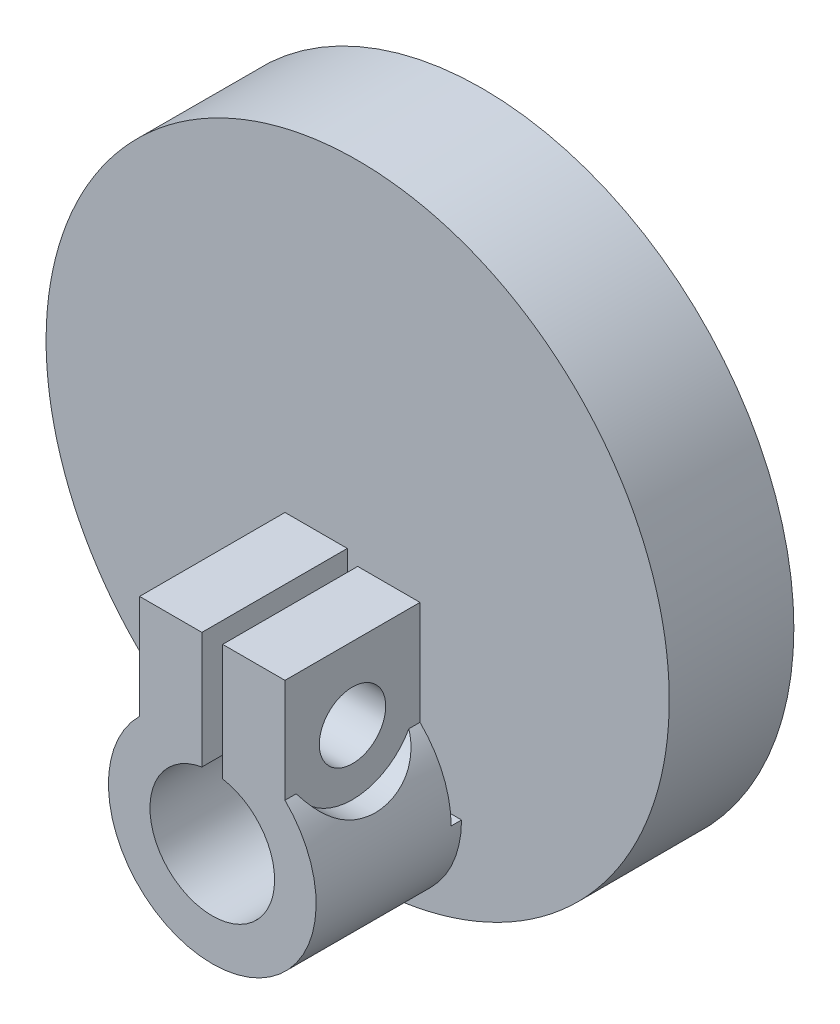
from build123d import *

# Parameters (mm, degrees)
SKETCH2_R                      = 15
SKETCH2_R_2                    = 3
BOSS_EXTRUDE1_DEPTH            = 6
BOSS_EXTRUDE2_DEPTH            = 7
CUT_EXTRUDE1_REACH             = 29.134
SKETCH4_W                      = 0.5
SKETCH4_H                      = 8.570714214
CUT_EXTRUDE1_DIRECTION_2_DEPTH = 28.133927102
SKETCH5_R                      = 1.6
CUT_EXTRUDE2_DEPTH             = 28.133927102
SKETCH6_R                      = 3.1
CUT_EXTRUDE3_DEPTH             = 28.133927206
SKETCH7_R                      = 3.1
CUT_EXTRUDE4_DEPTH             = 28.133927206


with BuildPart() as part:
    # Sketch2 → Boss-Extrude1 (new body)
    with BuildSketch(Plane.XY):
        Circle(SKETCH2_R)
        with Locations((0, -10)):
            Circle(SKETCH2_R_2, mode=Mode.SUBTRACT)
    extrude(amount=BOSS_EXTRUDE1_DEPTH)

    # Sketch3 → Boss-Extrude2 (add)
    with BuildSketch(Plane.XY.offset(6)):
        with BuildLine():
            Line((0.5, -7.041960108), (0.5, -1.429285786))
            Line((0.5, -1.429285786), (3.5, -1.429285786))
            Line((3.5, -1.429285786), (3.5, -6.429285786))
            ThreePointArc((3.5, -6.429285786), (0, -15), (-3.5, -6.429285786))
            Line((-3.5, -6.429285786), (-3.5, -1.429285786))
            Line((-3.5, -1.429285786), (-0.5, -1.429285786))
            Line((-0.5, -1.429285786), (-0.5, -7.041960108))
            ThreePointArc((-0.5, -7.041960108), (0, -13), (0.5, -7.041960108))
        make_face()
    extrude(amount=BOSS_EXTRUDE2_DEPTH)

    # Cut-Extrude1: up to this face of the body (flat: up to its plane)
    cut_extrude1_end = Plane(part.part.faces().sort_by_distance((-0.5, -4.235622947, 9.5))[0])
    # Sketch4 → Cut-Extrude1 (cut, up to the picked face)
    with BuildSketch(Plane(origin=(3.5, 0, 0), x_dir=(0, 0, -1), z_dir=(1, 0, 0)), mode=Mode.PRIVATE) as cut_extrude1_sk1:
        with Locations((-6.25, -5.714642893)):
            Rectangle(SKETCH4_W, SKETCH4_H)
    cut_extrude1_tool1 = split(extrude(cut_extrude1_sk1.sketch, amount=-CUT_EXTRUDE1_REACH, mode=Mode.PRIVATE), bisect_by=cut_extrude1_end, keep=Keep.BOTH, mode=Mode.PRIVATE)
    add(cut_extrude1_tool1.solids().sort_by(Axis((3.5, -5.714643, 6.25), (-1, 0, 0)))[0], mode=Mode.SUBTRACT)

    # Sketch4 → Cut-Extrude1 direction 2 (cut)
    with BuildSketch(Plane(origin=(3.5, 0, 0), x_dir=(0, 0, -1), z_dir=(1, 0, 0))):
        with Locations((-6.25, -5.714642893)):
            Rectangle(SKETCH4_W, SKETCH4_H)
    extrude(amount=CUT_EXTRUDE1_DIRECTION_2_DEPTH, mode=Mode.SUBTRACT)

    # Sketch5 → Cut-Extrude2 (cut, through all)
    with BuildSketch(Plane(origin=(3.5, 0, 0), x_dir=(0, 0, -1), z_dir=(1, 0, 0))):
        with Locations((-9.75, -4.929285786)):
            Circle(SKETCH5_R)
    extrude(amount=-CUT_EXTRUDE2_DEPTH, mode=Mode.SUBTRACT)

    # Sketch6 → Cut-Extrude3 (cut, through all)
    with BuildSketch(Plane(origin=(3.5, 0, 0), x_dir=(0, 0, -1), z_dir=(1, 0, 0))):
        with Locations((-9.75, -4.929285786)):
            Circle(SKETCH6_R)
    extrude(amount=CUT_EXTRUDE3_DEPTH, mode=Mode.SUBTRACT)

    # Sketch7 → Cut-Extrude4 (cut, through all)
    with BuildSketch(Plane.ZY.offset(3.5)):
        with Locations((9.75, -4.929285786)):
            Circle(SKETCH7_R)
    extrude(amount=CUT_EXTRUDE4_DEPTH, mode=Mode.SUBTRACT)


solid = part.part
